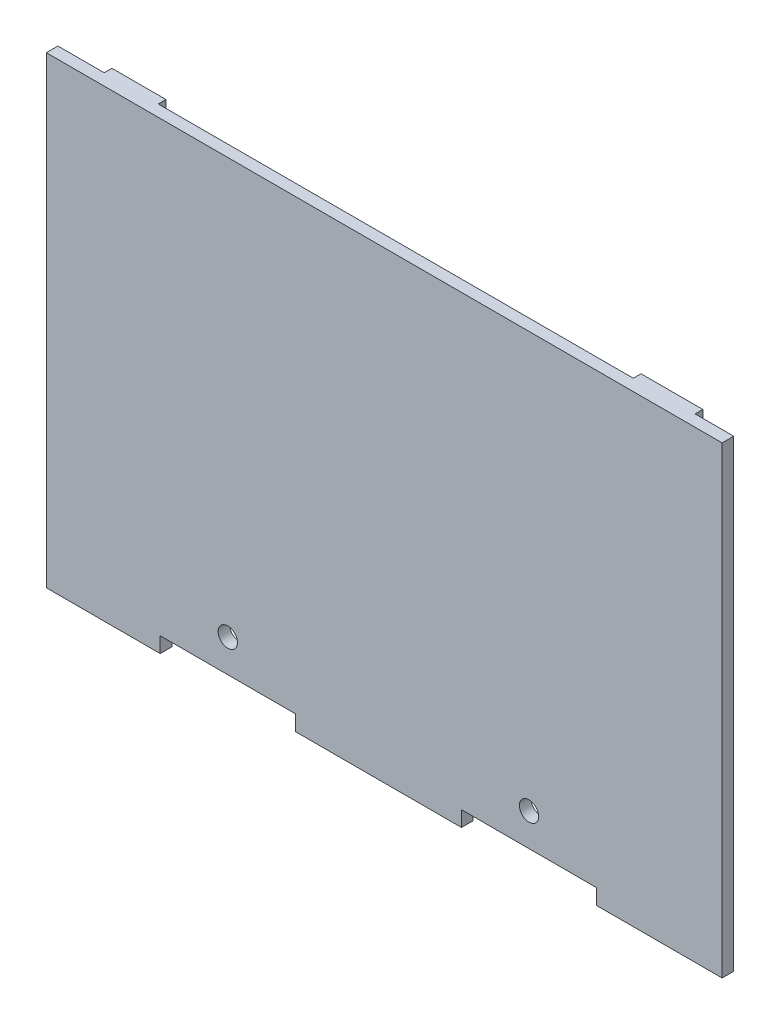
from build123d import *

# Parameters (mm, degrees)
BOSS_EXTRU_1_DEPTH      = 3
ESQUISSE3_W             = 14
ESQUISSE3_H             = 120
ESQUISSE3_W_2           = 16
BOSS_EXTRU_2_DEPTH      = 5
ESQUISSE4_R             = 2.5
ENL_V_MAT_EXTRU_1_DEPTH = 10


with BuildPart() as part:
    # Esquisse2 → Boss.-Extru.1 (new body)
    with BuildSketch(Plane.XY):
        Polygon((0, 0), (175, 0), (175, -120), (142.5, -120), (142.5, -116), (107.5, -116), (107.5, -120), (64.5, -120), (64.5, -116), (29.5, -116), (29.5, -120), (0, -120), align=None)
    extrude(amount=BOSS_EXTRU_1_DEPTH)

    # Esquisse3 → Boss.-Extru.2 (add)
    with BuildSketch(Plane.XY.offset(3)):
        with Locations((19, -60)):
            Rectangle(ESQUISSE3_W, ESQUISSE3_H)
        with Locations((157, -60)):
            Rectangle(ESQUISSE3_W_2, ESQUISSE3_H)
    extrude(amount=-BOSS_EXTRU_2_DEPTH)

    # Esquisse4 → Enlèv. mat.-Extru.1 (cut)
    with BuildSketch(Plane.XY.offset(3)):
        with Locations((47, -107.55)):
            Circle(ESQUISSE4_R)
        with Locations((125, -107.55)):
            Circle(ESQUISSE4_R)
    extrude(amount=-ENL_V_MAT_EXTRU_1_DEPTH, mode=Mode.SUBTRACT)


solid = part.part
